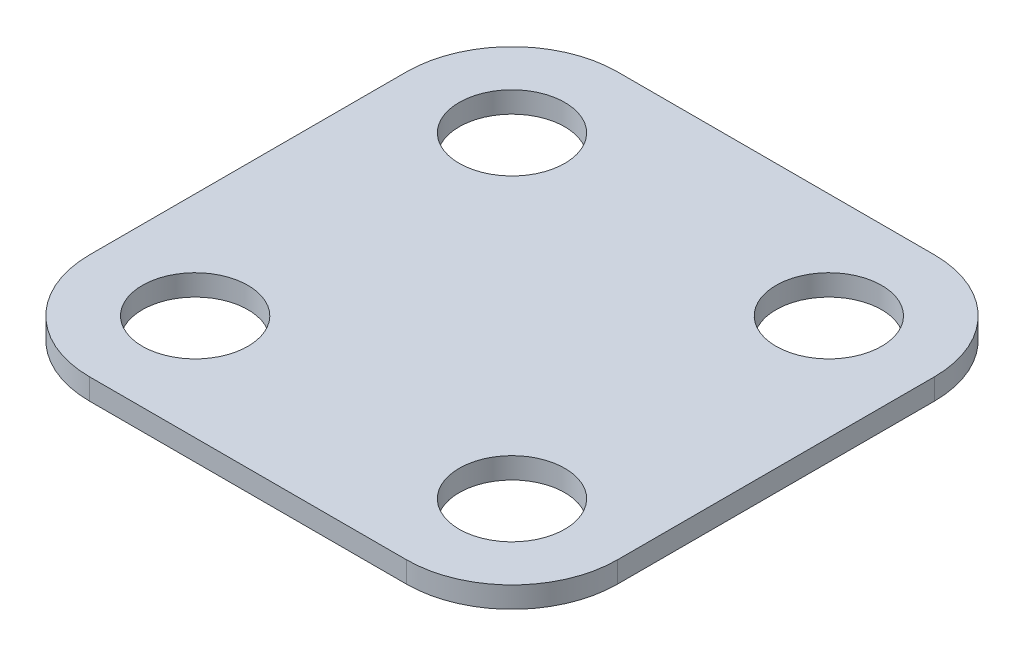
from build123d import *

# Parameters (mm, degrees)
SZKIC1_R                    = 5
DODANIE_WYCI_GNI_CIE1_DEPTH = 2


with BuildPart() as part:
    # Szkic1 → Dodanie-wyciągnięcie1 (new body)
    with BuildSketch(Plane(origin=(0, 0, 0), x_dir=(1, 0, 0), z_dir=(0, 1, 0))):
        with BuildLine():
            Line((-15, 25), (15, 25))
            ThreePointArc((15, 25), (22.071067812, 22.071067812), (25, 15))
            Line((25, 15), (25, -15))
            ThreePointArc((25, -15), (22.071067812, -22.071067812), (15, -25))
            Line((15, -25), (-15, -25))
            ThreePointArc((-15, -25), (-22.071067812, -22.071067812), (-25, -15))
            Line((-25, -15), (-25, 15))
            ThreePointArc((-25, 15), (-22.071067812, 22.071067812), (-15, 25))
        make_face()
        with Locations(Location((15, 15, 0), (0, 0, 270))):
            Circle(SZKIC1_R, mode=Mode.SUBTRACT)
        with Locations(Location((15, -15, 0), (0, 0, 270))):
            Circle(SZKIC1_R, mode=Mode.SUBTRACT)
        with Locations(Location((-15, -15, 0), (0, 0, 270))):
            Circle(SZKIC1_R, mode=Mode.SUBTRACT)
        with Locations(Location((-15, 15, 0), (0, 0, 270))):
            Circle(SZKIC1_R, mode=Mode.SUBTRACT)
    extrude(amount=-DODANIE_WYCI_GNI_CIE1_DEPTH)


solid = part.part
